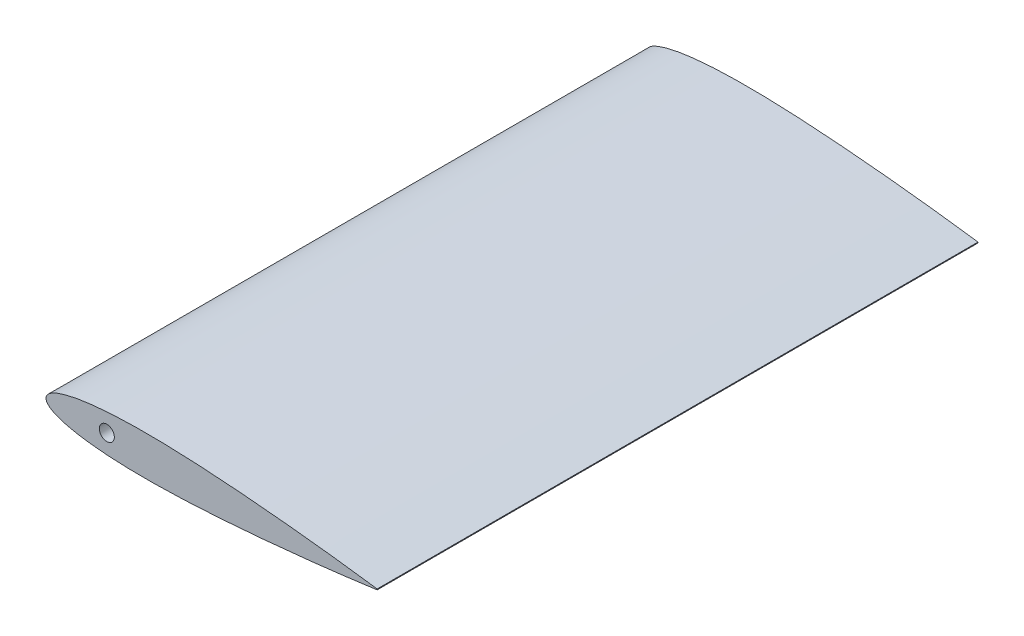
from build123d import *

# Parameters (mm, degrees)
BOSS_EXTRUDE4_DEPTH = 80
SKETCH8_R           = 1
CUT_EXTRUDE3_DEPTH  = 91.911371442


with BuildPart() as part:
    # Sketch7 → Boss-Extrude4 (new body)
    with BuildSketch(Plane.XY):
        with BuildLine():
            Line((1, -0.10458), (1, 0.006552))
            add(Edge.make_bspline(
                [(1, 0.006552), (0.158660801, 0.124727465), (-3.011604778, 0.553296947), (-7.426296131, 1.078650664), (-12.698984729, 1.622280872), (-16.696954397, 1.979309879), (-20.519318828, 2.259526479), (-23.687785093, 2.44374322), (-26.801187498, 2.56579063), (-29.794387909, 2.612172186), (-32.327162109, 2.576446202), (-34.397744397, 2.482512421), (-36.022113664, 2.36180268), (-37.507030652, 2.200553443), (-38.649022039, 2.029716932), (-39.481499593, 1.872022936), (-40.043713025, 1.748908125), (-40.561648345, 1.617733024), (-41.03416108, 1.479085277), (-41.460209338, 1.333425332), (-41.838884549, 1.181256266), (-42.169437107, 1.023017059), (-42.451237267, 0.859037156), (-42.683956884, 0.689594536), (-42.867146282, 0.514410475), (-43.000363693, 0.332988706), (-43.081813028, 0.144442461), (-43.108865092, -0.049014), (-43.081813028, -0.242470461), (-43.000363693, -0.431016706), (-42.867146282, -0.612438475), (-42.683956884, -0.787622536), (-42.451237267, -0.957065156), (-42.169437107, -1.121045059), (-41.838884549, -1.279284266), (-41.460209338, -1.431453332), (-41.03416108, -1.577113277), (-40.561648345, -1.715761024), (-40.043713025, -1.846936125), (-39.267976452, -2.016808732), (-38.192881528, -2.203621226), (-36.782881985, -2.384099047), (-34.930256604, -2.552209464), (-32.604733745, -2.670438773), (-29.449317016, -2.715075555), (-26.102193865, -2.645860532), (-22.634490798, -2.486549808), (-19.462407721, -2.284880754), (-15.994268713, -2.015630673), (-12.955274596, -1.739321086), (-9.038563577, -1.346632899), (-5.164689643, -0.91339158), (-1.466486188, -0.443611539), (0.380454215, -0.191304711), (0.922875159, -0.115413043), (1, -0.10458)],
                knots=[0, 0, 0, 0, 0.028342901, 0.106722049, 0.148306055, 0.205171367, 0.2406214, 0.276160573, 0.311047092, 0.344559266, 0.37601757, 0.395537659, 0.413698812, 0.430349273, 0.445356904, 0.452209372, 0.458611567, 0.464554044, 0.47002985, 0.475034902, 0.479569141, 0.483636857, 0.487250263, 0.490431338, 0.493218828, 0.495674086, 0.497891368, 0.5, 0.502108632, 0.504325914, 0.506781172, 0.509568662, 0.512749737, 0.516363143, 0.520430859, 0.524965098, 0.52997015, 0.535445956, 0.541388433, 0.547790628, 0.561933981, 0.577778559, 0.595202024, 0.62398243, 0.655440734, 0.700464146, 0.735649713, 0.771241831, 0.806495957, 0.851693945, 0.873039495, 0.937813387, 0.981728388, 0.997401831, 1, 1, 1, 1], degree=3))
        make_face()
    extrude(amount=BOSS_EXTRUDE4_DEPTH)

    # Sketch8 → Cut-Extrude3 (cut, through all)
    with BuildSketch(Plane.XY.offset(80)):
        with Locations((-35, 0)):
            Circle(SKETCH8_R)
    extrude(amount=-CUT_EXTRUDE3_DEPTH, mode=Mode.SUBTRACT)


solid = part.part
